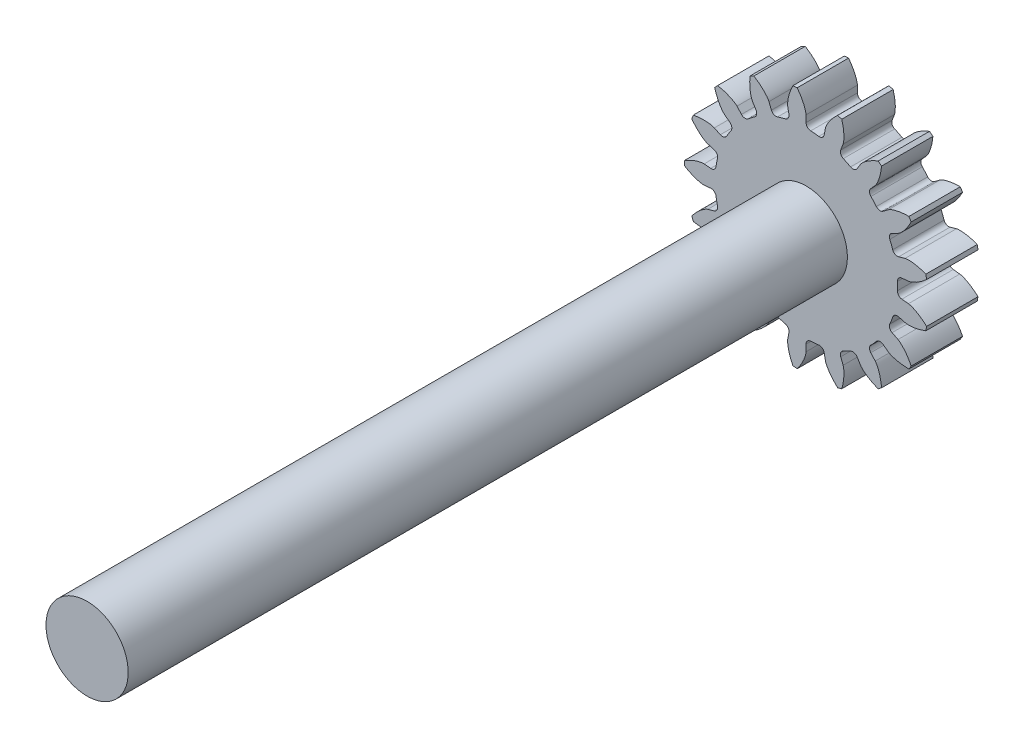
from build123d import *

# Parameters (mm, degrees)
BLANK_SKETCH_R      = 11.875
BLANK_DEPTH         = 5
TOOTH_SPACE_DEPTH   = 18.522307211
TEETH_COUNT         = 17
BORE_DEPTH          = 18.499960093
BORE_DEPTH_BACK     = 18.499960093
BORE_SKETCH_R       = 4
SKETCH1_R           = 4
BOSS_EXTRUDE1_DEPTH = 75


with BuildPart() as part:
    # Blank Sketch → Blank (new body)
    with BuildSketch(Plane.XY):
        Circle(BLANK_SKETCH_R)
    extrude(amount=BLANK_DEPTH)

    # Tooth Space Sketch → Tooth Space (cut, symmetric)
    with BuildSketch(Plane.XY):
        with BuildLine():
            Line((9.939079093, 0.948492097), (9.295694704, 0.887093551))
            ThreePointArc((9.295694704, 0.887093551), (8.98235795, 0.725899492), (8.866285625, 0.393197431))
            ThreePointArc((8.866285625, 0.393197431), (8.875, 0), (8.866285625, -0.393197431))
            ThreePointArc((8.866285625, -0.393197431), (8.98235795, -0.725899492), (9.295694704, -0.887093551))
            Line((9.295694704, -0.887093551), (9.939079093, -0.948492097))
            add(Edge.make_bspline(
                [(9.939079093, -0.948492097), (9.944419956, -0.949099255), (9.959363538, -0.951100483), (9.987461284, -0.956060515), (10.033024977, -0.965815194), (10.090612537, -0.980674949), (10.164414462, -1.002652043), (10.250457009, -1.032080202), (10.343964765, -1.068095975), (10.444451681, -1.11120542), (10.543514859, -1.15765376), (10.641151163, -1.207155784), (10.737293163, -1.259303994), (10.852346672, -1.325781398), (10.988299107, -1.410072048), (11.14406597, -1.515140112), (11.316856551, -1.641938971), (11.488524989, -1.779131562), (11.653706097, -1.920614485), (11.816027404, -2.070803406), (11.969819819, -2.2212394), (12.124556639, -2.38463298), (12.26486155, -2.539111634), (12.416223734, -2.71980126), (12.536695511, -2.867871874), (12.656096039, -3.026982739), (12.713455505, -3.105320734), (12.742448933, -3.145730469)],
                knots=[0, 0, 0, 0, 0, 0.005376748, 0.015083688, 0.02853182, 0.046610139, 0.064854849, 0.092110525, 0.119476176, 0.146842495, 0.174208854, 0.201574955, 0.228941013, 0.256307345, 0.307035032, 0.361767351, 0.41649966, 0.471231936, 0.525964282, 0.580696615, 0.635428982, 0.690161387, 0.744893688, 0.799626082, 0.854358408, 0.909090915, 0.909090915, 0.909090915, 0.909090915, 0.909090915], degree=4))
            Line((12.742448933, -3.145730469), (12.742448933, 3.145730469))
            add(Edge.make_bspline(
                [(9.939079093, 0.948492097), (9.944419956, 0.949099255), (9.959363538, 0.951100483), (9.987461284, 0.956060515), (10.033024977, 0.965815194), (10.090612537, 0.980674949), (10.164414462, 1.002652043), (10.250457009, 1.032080202), (10.343964765, 1.068095975), (10.444451681, 1.11120542), (10.543514859, 1.15765376), (10.641151163, 1.207155784), (10.737293163, 1.259303994), (10.852346672, 1.325781398), (10.988299107, 1.410072048), (11.14406597, 1.515140112), (11.316856551, 1.641938971), (11.488524989, 1.779131562), (11.653706097, 1.920614485), (11.816027404, 2.070803406), (11.969819819, 2.2212394), (12.124556639, 2.38463298), (12.26486155, 2.539111634), (12.416223734, 2.71980126), (12.536695511, 2.867871874), (12.656096039, 3.026982739), (12.713455505, 3.105320734), (12.742448933, 3.145730469)],
                knots=[0, 0, 0, 0, 0, 0.005376748, 0.015083688, 0.02853182, 0.046610139, 0.064854849, 0.092110525, 0.119476176, 0.146842495, 0.174208854, 0.201574955, 0.228941013, 0.256307345, 0.307035032, 0.361767351, 0.41649966, 0.471231936, 0.525964282, 0.580696615, 0.635428982, 0.690161387, 0.744893688, 0.799626082, 0.854358408, 0.909090915, 0.909090915, 0.909090915, 0.909090915, 0.909090915], degree=4))
        make_face()
    tooth_space = extrude(amount=TOOTH_SPACE_DEPTH, both=True, mode=Mode.SUBTRACT)

    # Teeth: Tooth Space ×17 about axis
    teeth_axis = Axis((0, 0, -0.25007105), (0, 0, 1))
    for i in range(1, TEETH_COUNT):
        add(tooth_space.rotate(teeth_axis, i * 360 / TEETH_COUNT), mode=Mode.SUBTRACT)

    # Bore Sketch → Bore (cut, two sides: drawn at the far end of the back side and taken through both)
    with BuildSketch(Plane.XY.offset(-BORE_DEPTH_BACK)):
        Circle(BORE_SKETCH_R)
    extrude(amount=BORE_DEPTH + BORE_DEPTH_BACK, mode=Mode.SUBTRACT)

    # Sketch1 → Boss-Extrude1 (add)
    with BuildSketch(Plane(origin=(0, 0, 0), x_dir=(-1, 0, 0), z_dir=(0, 0, -1))):
        Circle(SKETCH1_R)
    extrude(amount=-BOSS_EXTRUDE1_DEPTH)


solid = part.part
